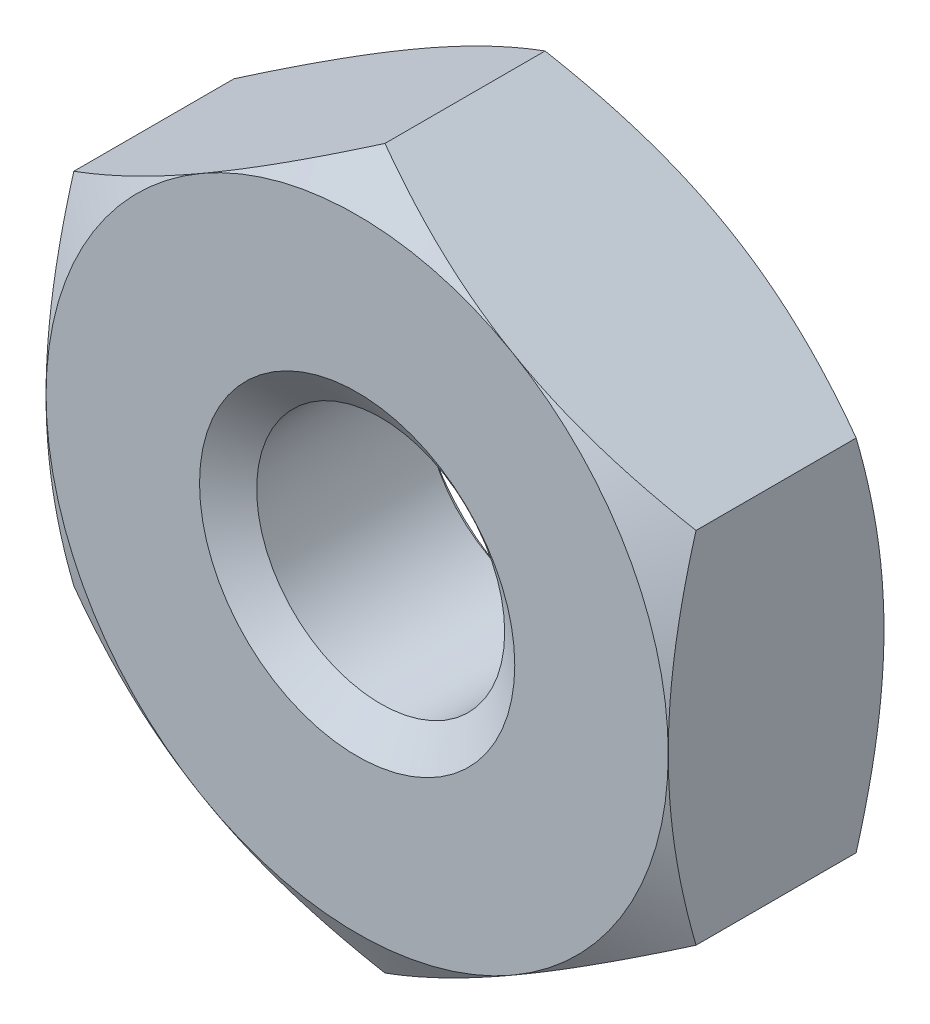
from build123d import *

# Parameters (mm, degrees)
BASENUT_START = -3.302
BASENUTSKE_R  = 1.89865
BASENUT_DEPTH = 3.302


with BuildPart() as part:
    # BaseNutSke → BaseNut (new body)
    with BuildSketch(Plane.XY.offset(BASENUT_START)):
        Polygon((4.7625, 2.749630657), (4.7625, -2.749630657), (0, -5.499261314), (-4.7625, -2.749630657), (-4.7625, 2.749630657), (0, 5.499261314), align=None)
        Circle(BASENUTSKE_R, mode=Mode.SUBTRACT)
    extrude(amount=BASENUT_DEPTH)

    # Sketch3 → Double-Chamfer (revolve, cut)
    with BuildSketch(Plane(origin=(0, 0, 0), x_dir=(0, 0, -1), z_dir=(1, 0, 0))):
        Polygon((3.302, 4.7625), (2.876630657, 5.499261314), (2.876630657, 18.199261314), (16.002, 18.199261314), (16.002, 4.7625), align=None)
        Polygon((0.425369343, 18.199261314), (-12.7, 18.199261314), (-12.7, 4.7625), (0, 4.7625), (0.425369343, 5.499261314), align=None)
    revolve(axis=Axis((0, 0, 0), (0, 0, -1)), mode=Mode.SUBTRACT)

    # EndChamferSketch → EndChamfer (revolve, cut)
    with BuildSketch(Plane(origin=(0, 0, 0), x_dir=(0, 0, -1), z_dir=(1, 0, 0)), mode=Mode.PRIVATE) as endchamfer_sk:
        Polygon((3.2766, 2.413), (2.880433078, 1.847215), (3.3274, 1.847215), (3.3274, 2.413), align=None)
        Polygon((-0.0508, 2.413), (0, 2.413), (0.396166922, 1.847215), (-0.0508, 1.847215), align=None)
    revolve(endchamfer_sk.sketch.rotate(Axis((0, 0, -25.037505729), (0, 0, -1)), 90), axis=Axis((0, 0, -25.037505729), (0, 0, -1)), mode=Mode.SUBTRACT)


solid = part.part
